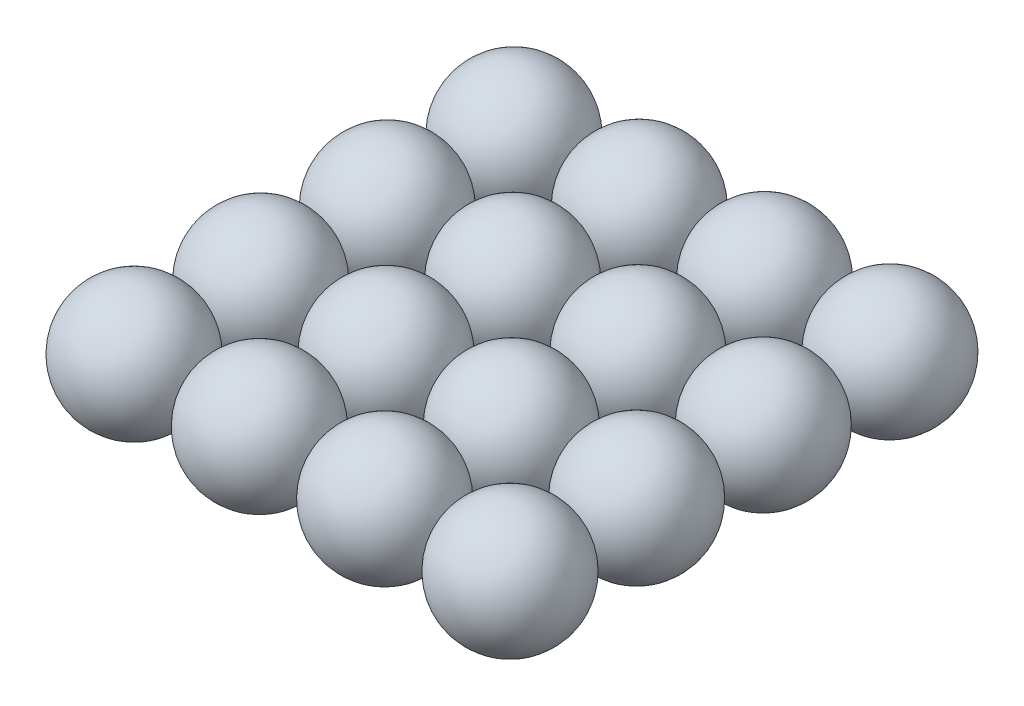
from build123d import *

# Parameters (mm, degrees)
LPATTERN6_COUNT = 4
LPATTERN6_PITCH = 193
LPATTERN7_COUNT = 4
LPATTERN7_PITCH = 191


with BuildPart() as part:
    # Sketch1 → Revolve1 (revolve)
    with BuildSketch(Plane.XY):
        with BuildLine():
            Line((0, 95), (0, -95))
            ThreePointArc((0, -95), (-95, 0), (0, 95))
        make_face()
    revolve(axis=Axis((0, 95, 0), (0, -1, 0)))


with BuildPart() as lpattern6_1:
    # LPattern6: pattern copy
    add(part.part.moved(Location(Vector(0, 0, -1) * (1 * LPATTERN6_PITCH))))


with BuildPart() as lpattern6_2:
    # LPattern6: pattern copy
    add(part.part.moved(Location(Vector(0, 0, -1) * (2 * LPATTERN6_PITCH))))


with BuildPart() as lpattern6_3:
    # LPattern6: pattern copy
    add(part.part.moved(Location(Vector(0, 0, -1) * (3 * LPATTERN6_PITCH))))


with BuildPart() as lpattern7_1:
    # LPattern7: pattern copy
    add(part.part.moved(Location(Vector(1, 0, 0) * (1 * LPATTERN7_PITCH))))


with BuildPart() as lpattern7_2:
    # LPattern7: pattern copy
    add(part.part.moved(Location(Vector(1, 0, 0) * (2 * LPATTERN7_PITCH))))


with BuildPart() as lpattern7_3:
    # LPattern7: pattern copy
    add(part.part.moved(Location(Vector(1, 0, 0) * (3 * LPATTERN7_PITCH))))


with BuildPart() as lpattern7_4:
    # LPattern7: pattern copy
    add(lpattern6_1.part.moved(Location(Vector(1, 0, 0) * (1 * LPATTERN7_PITCH))))


with BuildPart() as lpattern7_5:
    # LPattern7: pattern copy
    add(lpattern6_1.part.moved(Location(Vector(1, 0, 0) * (2 * LPATTERN7_PITCH))))


with BuildPart() as lpattern7_6:
    # LPattern7: pattern copy
    add(lpattern6_1.part.moved(Location(Vector(1, 0, 0) * (3 * LPATTERN7_PITCH))))


with BuildPart() as lpattern7_7:
    # LPattern7: pattern copy
    add(lpattern6_2.part.moved(Location(Vector(1, 0, 0) * (1 * LPATTERN7_PITCH))))


with BuildPart() as lpattern7_8:
    # LPattern7: pattern copy
    add(lpattern6_2.part.moved(Location(Vector(1, 0, 0) * (2 * LPATTERN7_PITCH))))


with BuildPart() as lpattern7_9:
    # LPattern7: pattern copy
    add(lpattern6_2.part.moved(Location(Vector(1, 0, 0) * (3 * LPATTERN7_PITCH))))


with BuildPart() as lpattern7_10:
    # LPattern7: pattern copy
    add(lpattern6_3.part.moved(Location(Vector(1, 0, 0) * (1 * LPATTERN7_PITCH))))


with BuildPart() as lpattern7_11:
    # LPattern7: pattern copy
    add(lpattern6_3.part.moved(Location(Vector(1, 0, 0) * (2 * LPATTERN7_PITCH))))


with BuildPart() as lpattern7_12:
    # LPattern7: pattern copy
    add(lpattern6_3.part.moved(Location(Vector(1, 0, 0) * (3 * LPATTERN7_PITCH))))


solid = Compound([part.part, lpattern6_1.part, lpattern6_2.part, lpattern6_3.part, lpattern7_1.part, lpattern7_2.part, lpattern7_3.part, lpattern7_4.part, lpattern7_5.part, lpattern7_6.part, lpattern7_7.part, lpattern7_8.part, lpattern7_9.part, lpattern7_10.part, lpattern7_11.part, lpattern7_12.part])
